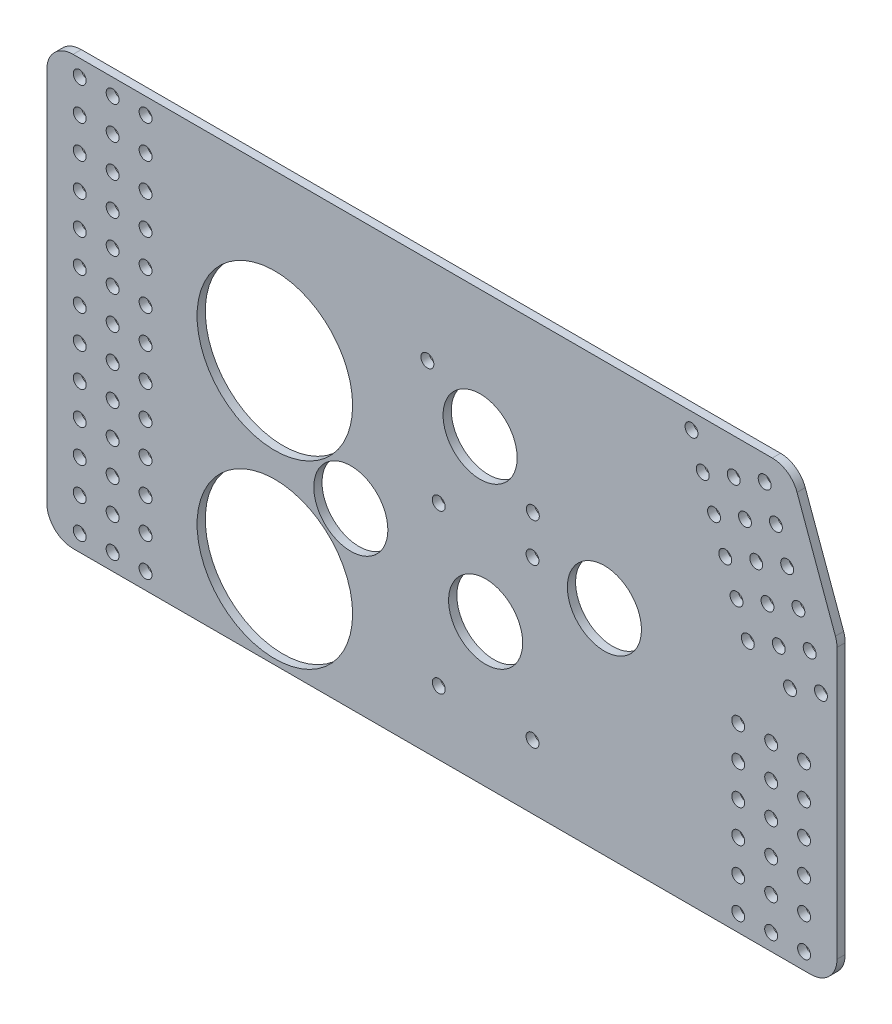
from build123d import *

# Parameters (mm, degrees)
SKETCH1_R           = 2.4892
SKETCH1_R_2         = 14.2875
SKETCH1_R_3         = 29.9974
BOSS_EXTRUDE1_DEPTH = 3.175
FILLET1_R           = 10.16


with BuildPart() as part:
    # Sketch1 → Boss-Extrude1 (new body)
    with BuildSketch(Plane.XY):
        Polygon((-152.4, 0), (152.4, 0), (152.4, 116.084254136), (134.559727495, 165.1), (-152.4, 165.1), align=None)
        with Locations((-139.7, 158.75)):
            Circle(SKETCH1_R, mode=Mode.SUBTRACT)
        with Locations((96.278017777, 158.881185382)):
            Circle(SKETCH1_R, mode=Mode.SUBTRACT)
        with Locations((112.555769881, 151.290744918)):
            Circle(SKETCH1_R, mode=Mode.SUBTRACT)
        with Locations((124.489866165, 155.634400739)):
            Circle(SKETCH1_R, mode=Mode.SUBTRACT)
        with Locations((114.3, 69.85)):
            Circle(SKETCH1_R, mode=Mode.SUBTRACT)
        with Locations((127, 69.85)):
            Circle(SKETCH1_R, mode=Mode.SUBTRACT)
        with Locations((139.7, 69.85)):
            Circle(SKETCH1_R, mode=Mode.SUBTRACT)
        with Locations((100.621673597, 146.947089098)):
            Circle(SKETCH1_R, mode=Mode.SUBTRACT)
        with Locations((116.899425702, 139.356648634)):
            Circle(SKETCH1_R, mode=Mode.SUBTRACT)
        with Locations((128.833521986, 143.700304455)):
            Circle(SKETCH1_R, mode=Mode.SUBTRACT)
        with Locations((104.965329418, 135.012992814)):
            Circle(SKETCH1_R, mode=Mode.SUBTRACT)
        with Locations((121.243081522, 127.42255235)):
            Circle(SKETCH1_R, mode=Mode.SUBTRACT)
        with Locations((133.177177806, 131.766208171)):
            Circle(SKETCH1_R, mode=Mode.SUBTRACT)
        with Locations((109.308985238, 123.07889653)):
            Circle(SKETCH1_R, mode=Mode.SUBTRACT)
        with Locations((125.586737342, 115.488456066)):
            Circle(SKETCH1_R, mode=Mode.SUBTRACT)
        with Locations((137.520833626, 119.832111887)):
            Circle(SKETCH1_R, mode=Mode.SUBTRACT)
        with Locations((113.652641058, 111.144800246)):
            Circle(SKETCH1_R, mode=Mode.SUBTRACT)
        with Locations((129.930393162, 103.554359782)):
            Circle(SKETCH1_R, mode=Mode.SUBTRACT)
        with Locations((141.864489446, 107.898015603)):
            Circle(SKETCH1_R, mode=Mode.SUBTRACT)
        with Locations((117.996296878, 99.210703962)):
            Circle(SKETCH1_R, mode=Mode.SUBTRACT)
        with Locations((134.274048982, 91.620263498)):
            Circle(SKETCH1_R, mode=Mode.SUBTRACT)
        with Locations((146.208145266, 95.963919319)):
            Circle(SKETCH1_R, mode=Mode.SUBTRACT)
        with Locations((114.3, 57.15)):
            Circle(SKETCH1_R, mode=Mode.SUBTRACT)
        with Locations((127, 57.15)):
            Circle(SKETCH1_R, mode=Mode.SUBTRACT)
        with Locations((139.7, 57.15)):
            Circle(SKETCH1_R, mode=Mode.SUBTRACT)
        with Locations((114.3, 44.45)):
            Circle(SKETCH1_R, mode=Mode.SUBTRACT)
        with Locations((127, 44.45)):
            Circle(SKETCH1_R, mode=Mode.SUBTRACT)
        with Locations((139.7, 44.45)):
            Circle(SKETCH1_R, mode=Mode.SUBTRACT)
        with Locations((114.3, 31.75)):
            Circle(SKETCH1_R, mode=Mode.SUBTRACT)
        with Locations((127, 31.75)):
            Circle(SKETCH1_R, mode=Mode.SUBTRACT)
        with Locations((139.7, 31.75)):
            Circle(SKETCH1_R, mode=Mode.SUBTRACT)
        with Locations((114.3, 19.05)):
            Circle(SKETCH1_R, mode=Mode.SUBTRACT)
        with Locations((127, 19.05)):
            Circle(SKETCH1_R, mode=Mode.SUBTRACT)
        with Locations((139.7, 19.05)):
            Circle(SKETCH1_R, mode=Mode.SUBTRACT)
        with Locations((114.3, 6.35)):
            Circle(SKETCH1_R, mode=Mode.SUBTRACT)
        with Locations((127, 6.35)):
            Circle(SKETCH1_R, mode=Mode.SUBTRACT)
        with Locations((139.7, 6.35)):
            Circle(SKETCH1_R, mode=Mode.SUBTRACT)
        with Locations((-127, 158.75)):
            Circle(SKETCH1_R, mode=Mode.SUBTRACT)
        with Locations((-114.3, 158.75)):
            Circle(SKETCH1_R, mode=Mode.SUBTRACT)
        with Locations((-127, 146.05)):
            Circle(SKETCH1_R, mode=Mode.SUBTRACT)
        with Locations((-114.3, 146.05)):
            Circle(SKETCH1_R, mode=Mode.SUBTRACT)
        with Locations((-127, 133.35)):
            Circle(SKETCH1_R, mode=Mode.SUBTRACT)
        with Locations((-114.3, 133.35)):
            Circle(SKETCH1_R, mode=Mode.SUBTRACT)
        with Locations((-127, 120.65)):
            Circle(SKETCH1_R, mode=Mode.SUBTRACT)
        with Locations((-114.3, 120.65)):
            Circle(SKETCH1_R, mode=Mode.SUBTRACT)
        with Locations((-127, 107.95)):
            Circle(SKETCH1_R, mode=Mode.SUBTRACT)
        with Locations((-114.3, 107.95)):
            Circle(SKETCH1_R, mode=Mode.SUBTRACT)
        with Locations((-127, 95.25)):
            Circle(SKETCH1_R, mode=Mode.SUBTRACT)
        with Locations((-114.3, 95.25)):
            Circle(SKETCH1_R, mode=Mode.SUBTRACT)
        with Locations((-127, 82.55)):
            Circle(SKETCH1_R, mode=Mode.SUBTRACT)
        with Locations((-114.3, 82.55)):
            Circle(SKETCH1_R, mode=Mode.SUBTRACT)
        with Locations((-127, 69.85)):
            Circle(SKETCH1_R, mode=Mode.SUBTRACT)
        with Locations((-114.3, 69.85)):
            Circle(SKETCH1_R, mode=Mode.SUBTRACT)
        with Locations((-127, 57.15)):
            Circle(SKETCH1_R, mode=Mode.SUBTRACT)
        with Locations((-114.3, 57.15)):
            Circle(SKETCH1_R, mode=Mode.SUBTRACT)
        with Locations((-127, 44.45)):
            Circle(SKETCH1_R, mode=Mode.SUBTRACT)
        with Locations((-114.3, 44.45)):
            Circle(SKETCH1_R, mode=Mode.SUBTRACT)
        with Locations((-127, 31.75)):
            Circle(SKETCH1_R, mode=Mode.SUBTRACT)
        with Locations((-114.3, 31.75)):
            Circle(SKETCH1_R, mode=Mode.SUBTRACT)
        with Locations((-127, 19.05)):
            Circle(SKETCH1_R, mode=Mode.SUBTRACT)
        with Locations((-114.3, 19.05)):
            Circle(SKETCH1_R, mode=Mode.SUBTRACT)
        with Locations((-127, 6.35)):
            Circle(SKETCH1_R, mode=Mode.SUBTRACT)
        with Locations((-114.3, 6.35)):
            Circle(SKETCH1_R, mode=Mode.SUBTRACT)
        with Locations((-139.7, 146.05)):
            Circle(SKETCH1_R, mode=Mode.SUBTRACT)
        with Locations((-139.7, 133.35)):
            Circle(SKETCH1_R, mode=Mode.SUBTRACT)
        with Locations((-139.7, 120.65)):
            Circle(SKETCH1_R, mode=Mode.SUBTRACT)
        with Locations((-139.7, 107.95)):
            Circle(SKETCH1_R, mode=Mode.SUBTRACT)
        with Locations((-139.7, 95.25)):
            Circle(SKETCH1_R, mode=Mode.SUBTRACT)
        with Locations((-139.7, 82.55)):
            Circle(SKETCH1_R, mode=Mode.SUBTRACT)
        with Locations((-139.7, 69.85)):
            Circle(SKETCH1_R, mode=Mode.SUBTRACT)
        with Locations((-139.7, 57.15)):
            Circle(SKETCH1_R, mode=Mode.SUBTRACT)
        with Locations((-139.7, 44.45)):
            Circle(SKETCH1_R, mode=Mode.SUBTRACT)
        with Locations((-139.7, 31.75)):
            Circle(SKETCH1_R, mode=Mode.SUBTRACT)
        with Locations((-139.7, 19.05)):
            Circle(SKETCH1_R, mode=Mode.SUBTRACT)
        with Locations((-139.7, 6.35)):
            Circle(SKETCH1_R, mode=Mode.SUBTRACT)
        with Locations((14.747605731, 115.915231493)):
            Circle(SKETCH1_R_2, mode=Mode.SUBTRACT)
        with Locations((-35.124454019, 66.937360953)):
            Circle(SKETCH1_R_2, mode=Mode.SUBTRACT)
        with Locations((16.872346339, 55.177887184)):
            Circle(SKETCH1_R_2, mode=Mode.SUBTRACT)
        with Locations((62.683226079, 82.500385193)):
            Circle(SKETCH1_R_2, mode=Mode.SUBTRACT)
        with Locations((-64.43319304, 101.664655725)):
            Circle(SKETCH1_R_3, mode=Mode.SUBTRACT)
        with Locations((-64.43319304, 32.068655725)):
            Circle(SKETCH1_R_3, mode=Mode.SUBTRACT)
        with Locations((-5.591406845, 131.129848394)):
            Circle(SKETCH1_R, mode=Mode.SUBTRACT)
        with Locations((35.086618307, 100.700614592)):
            Circle(SKETCH1_R, mode=Mode.SUBTRACT)
        with Locations((-1.212453661, 24.647087184)):
            Circle(SKETCH1_R, mode=Mode.SUBTRACT)
        with Locations((34.957146339, 24.647087184)):
            Circle(SKETCH1_R, mode=Mode.SUBTRACT)
        with Locations((34.957146339, 85.708687184)):
            Circle(SKETCH1_R, mode=Mode.SUBTRACT)
        with Locations((-1.212453661, 85.708687184)):
            Circle(SKETCH1_R, mode=Mode.SUBTRACT)
    extrude(amount=BOSS_EXTRUDE1_DEPTH)

    # Fillet1
    fillet1_edges = [part.edges().sort_by_distance(p)[0] for p in [
        (-152.4, 165.1, 1.5875),
        (134.559727495, 165.1, 1.5875),
        (152.4, 116.084254136, 1.5875),
        (152.4, 0, 1.5875),
        (-152.4, 0, 1.5875),
    ]]
    fillet(fillet1_edges, radius=FILLET1_R)


solid = part.part
